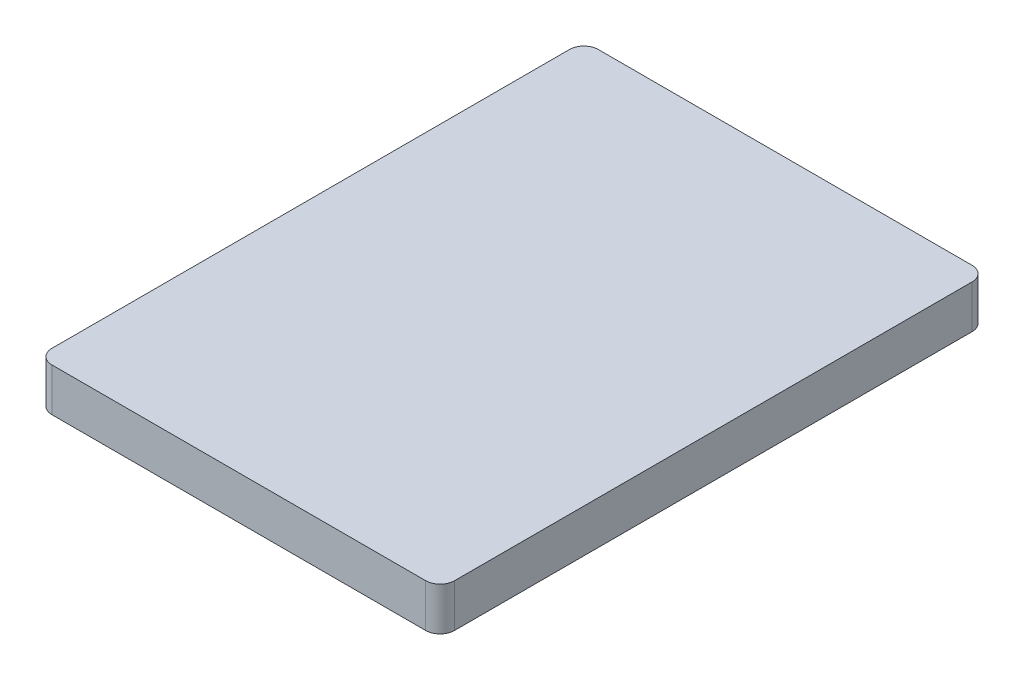
from build123d import *

# Parameters (mm, degrees)
SKETCH_1_W          = 56
SKETCH_1_H          = 6
SUPPORT_PLATE_DEPTH = 76
FILLET_2_R          = 2


with BuildPart() as part:
    # 草图1 → Support_plate (new body)
    with BuildSketch(Plane.XY):
        with Locations((28, 3)):
            Rectangle(SKETCH_1_W, SKETCH_1_H)
    extrude(amount=SUPPORT_PLATE_DEPTH)

    # Fillet 2
    fillet_2_edges = [part.edges().sort_by_distance(p)[0] for p in [
        (56, 3, 76),
        (0, 3, 76),
        (56, 3, 0),
        (0, 3, 0),
    ]]
    fillet(fillet_2_edges, radius=FILLET_2_R)


solid = part.part
